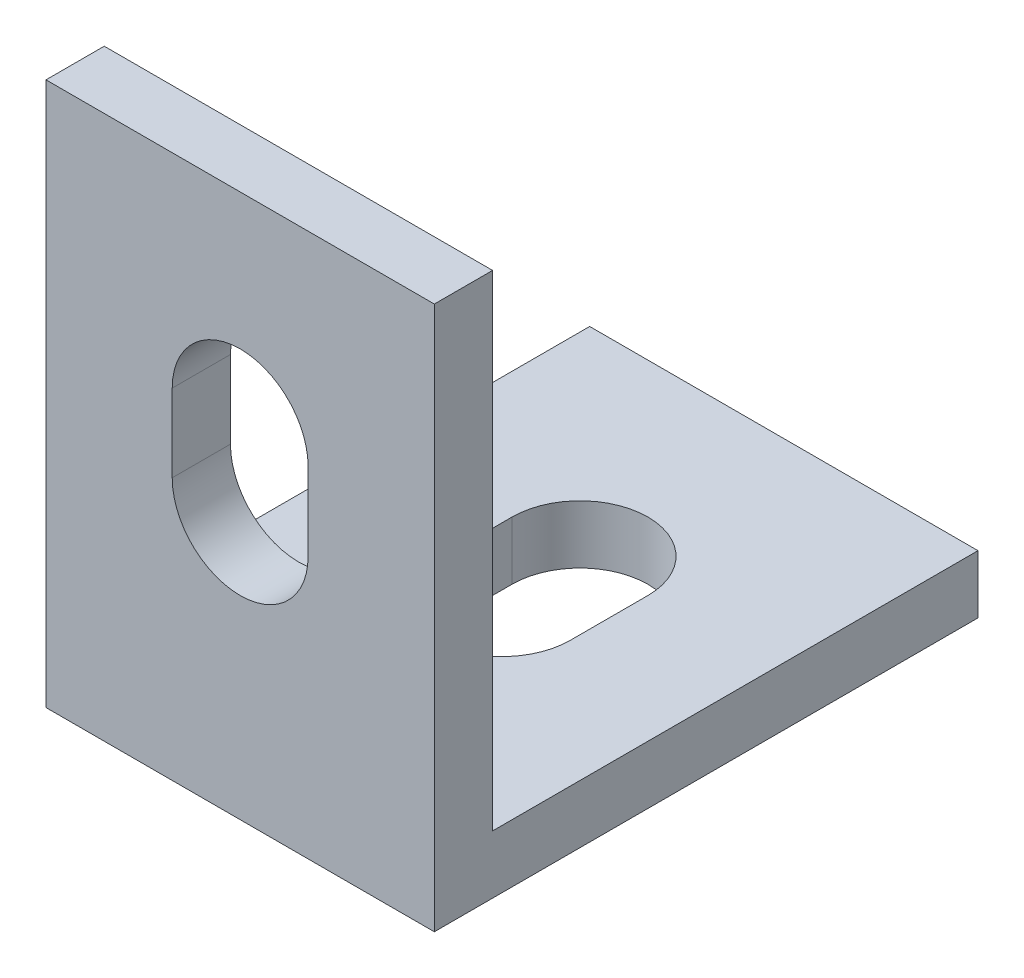
from build123d import *

# Parameters (mm, degrees)
BOSS_EXTRUDE2_DEPTH = 20
CUT_EXTRUDE1_DEPTH  = 3
CUT_EXTRUDE2_DEPTH  = 3


with BuildPart() as part:
    # Sketch1 → Boss-Extrude2 (new body)
    with BuildSketch(Plane(origin=(0, 0, 0), x_dir=(0, 0, -1), z_dir=(1, 0, 0))):
        Polygon((0, 0), (0, -28), (28, -28), (28, -25), (3, -25), (3, 0), align=None)
    extrude(amount=-BOSS_EXTRUDE2_DEPTH)

    # Sketch4 → Cut-Extrude1 (cut)
    with BuildSketch(Plane(origin=(0, -25, 0), x_dir=(1, 0, 0), z_dir=(0, 1, 0))):
        with BuildLine():
            Line((-6.5, 17.5), (-6.5, 13.5))
            ThreePointArc((-6.5, 13.5), (-10, 10), (-13.5, 13.5))
            Line((-13.5, 13.5), (-13.5, 17.5))
            ThreePointArc((-13.5, 17.5), (-10, 21), (-6.5, 17.5))
        make_face()
    extrude(amount=-CUT_EXTRUDE1_DEPTH, mode=Mode.SUBTRACT)

    # Sketch5 → Cut-Extrude2 (cut)
    with BuildSketch(Plane(origin=(0, 0, -3), x_dir=(-1, 0, 0), z_dir=(0, 0, -1))):
        with BuildLine():
            Line((13.5, -10.5), (13.5, -14.5))
            ThreePointArc((13.5, -14.5), (10, -18), (6.5, -14.5))
            Line((6.5, -14.5), (6.5, -10.5))
            ThreePointArc((6.5, -10.5), (10, -7), (13.5, -10.5))
        make_face()
    extrude(amount=-CUT_EXTRUDE2_DEPTH, mode=Mode.SUBTRACT)


solid = part.part
